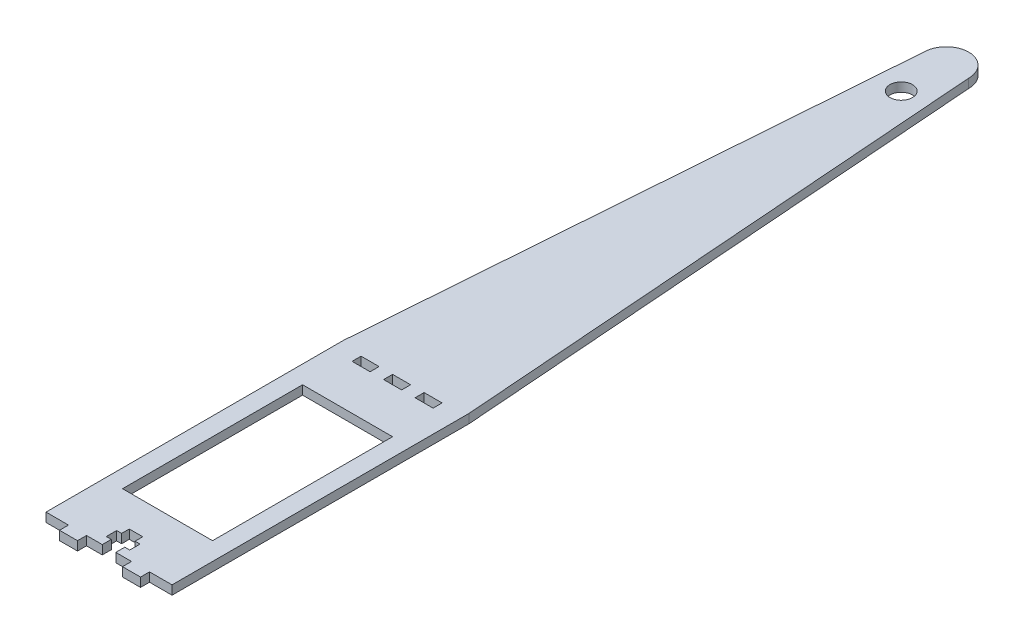
from build123d import *

# Parameters (mm, degrees)
SKETCH1_W           = 20
SKETCH1_H           = 40
SKETCH1_W_2         = 4
SKETCH1_H_2         = 2
BOSS_EXTRUDE1_DEPTH = 2
SKETCH2_R           = 2.5
BOSS_EXTRUDE2_DEPTH = 2


with BuildPart() as part:
    # Sketch1 → Boss-Extrude1 (new body)
    with BuildSketch(Plane(origin=(0, 0, 0), x_dir=(1, 0, 0), z_dir=(0, 1, 0))):
        Polygon((0, 0), (5, 0), (5, -2), (9, -2), (9, 0), (12.5, 0), (12.5, 2), (11.4, 2), (11.4, 4.3), (12.5, 4.3), (12.5, 6), (15.5, 6), (15.5, 4.3), (16.6, 4.3), (16.6, 2), (15.5, 2), (15.5, 0), (19, 0), (19, -2), (23, -2), (23, 0), (28, 0), (28, 66), (0, 66), align=None)
        with Locations((14, 33)):
            Rectangle(SKETCH1_W, SKETCH1_H, mode=Mode.SUBTRACT)
        with Locations((7, 64)):
            Rectangle(SKETCH1_W_2, SKETCH1_H_2, mode=Mode.SUBTRACT)
        with Locations((21, 64)):
            Rectangle(SKETCH1_W_2, SKETCH1_H_2, mode=Mode.SUBTRACT)
        with Locations((14, 64)):
            Rectangle(SKETCH1_W_2, SKETCH1_H_2, mode=Mode.SUBTRACT)
    extrude(amount=BOSS_EXTRUDE1_DEPTH)

    # Sketch2 → Boss-Extrude2 (add)
    with BuildSketch(Plane(origin=(0, 2, 0), x_dir=(1, 0, 0), z_dir=(0, 1, 0))):
        with BuildLine():
            Line((28, 66), (19, 186))
            ThreePointArc((19, 186), (14, 191), (9, 186))
            Line((9, 186), (0, 66))
            Line((0, 66), (28, 66))
        make_face()
        with Locations(Location((14, 176, 0), (0, 0, 270))):
            Circle(SKETCH2_R, mode=Mode.SUBTRACT)
    extrude(amount=-BOSS_EXTRUDE2_DEPTH)


solid = part.part
